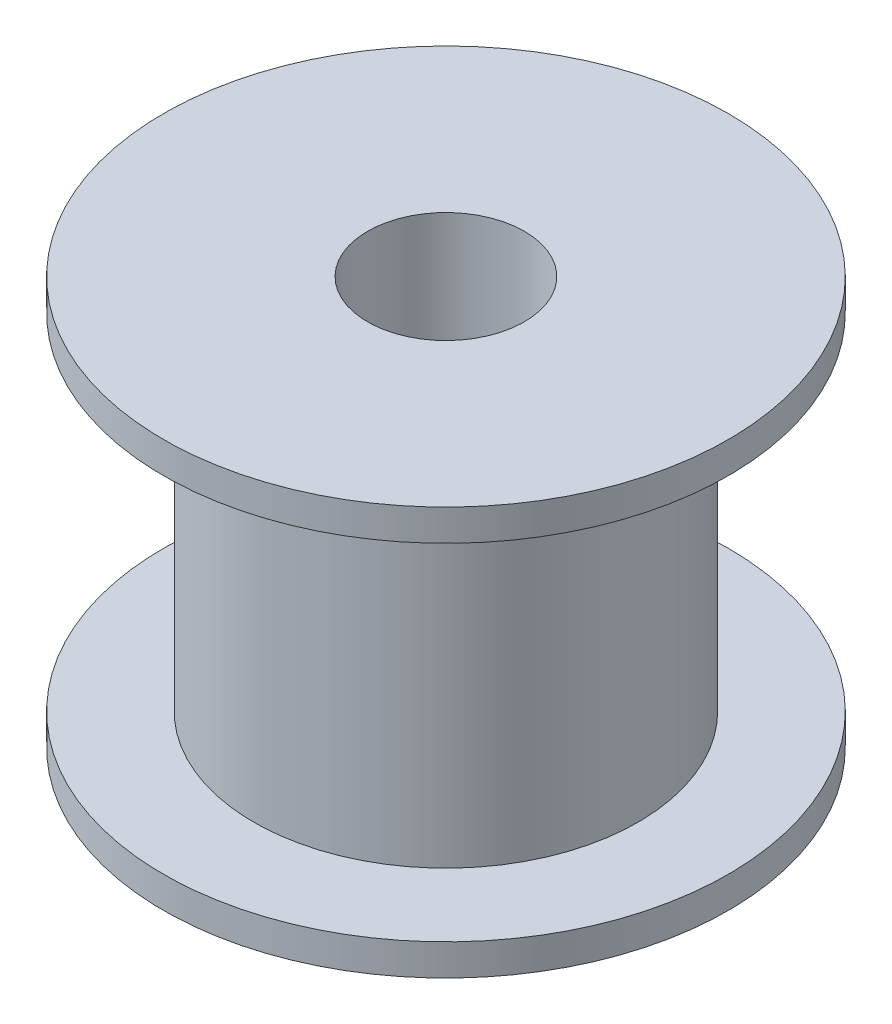
from build123d import *


with BuildPart() as part:
    # Sketch1 → Revolve1 (revolve)
    with BuildSketch(Plane.XY, mode=Mode.PRIVATE) as revolve1_sk:
        Polygon((2.5, 0), (2.5, 13), (9, 13), (9, 12), (6.125, 12), (6.125, 1), (9, 1), (9, 0), align=None)
    revolve(revolve1_sk.sketch.rotate(Axis((0, 0, 0), (0, 1, 0)), 90), axis=Axis((0, 0, 0), (0, 1, 0)))


solid = part.part
